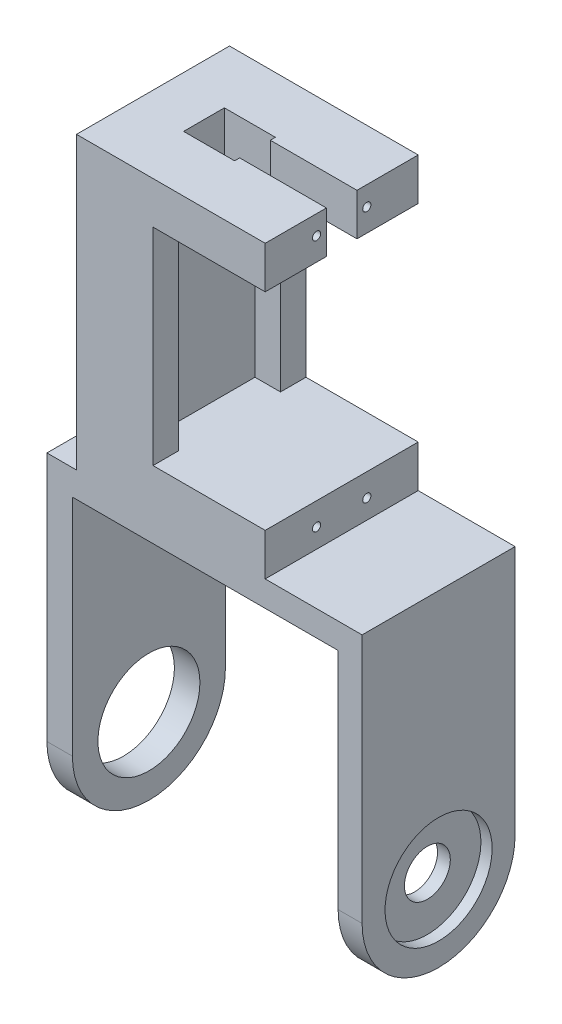
from build123d import *

# Parameters (mm, degrees)
ESQUISSE1_W               = 60.5
ESQUISSE1_H               = 64
BOSS_EXTRU_1_DEPTH        = 30
ESQUISSE2_R               = 4.5
ENL_V_MAT_EXTRU_1_DEPTH   = 32
ENL_V_MAT_EXTRU_2_REACH   = 55.283
ESQUISSE4_W               = 52.1
ESQUISSE4_H               = 83.557669167
ESQUISSE5_R               = 10.5
ENL_V_MAT_EXTRU_3_DEPTH   = 1.7
ESQUISSE6_R               = 10
ENL_V_MAT_EXTRU_4_DEPTH   = 4.2
ESQUISSE7_W               = 47
ESQUISSE7_H               = 57
BOSS_EXTRU_2_DEPTH        = 30
ENL_V_MAT_EXTRU_5_DEPTH   = 30
ENL_V_MAT_EXTRU_6_DEPTH   = 8.25
ESQUISSE11_W              = 5
ESQUISSE11_H              = 40.5
BOSS_EXTRU_3_DEPTH        = 5
ESQUISSE12_R              = 0.5
ENL_V_MAT_EXTRU_7_DEPTH   = 15
TROU_TARAUD_M2X0_42_D     = 1.6
TROU_TARAUD_M2X0_42_DEPTH = 17
TROU_TARAUD_M2X0_42_TIP   = 0.480688495
ENL_V_MAT_EXTRU_8_REACH   = 113.72
TROU_TARAUD_M3X0_54_D     = 2.5
TROU_TARAUD_M3X0_54_DEPTH = 17.5
TROU_TARAUD_M3X0_54_TIP   = 0.751075774
ENL_V_MAT_EXTRU_9_REACH   = 100.671
ESQUISSE26_W              = 5
ESQUISSE26_H              = 64.513244551
BOSS_EXTRU_4_START        = 0.8
ESQUISSE27_R              = 10
BOSS_EXTRU_4_DEPTH        = 0.8
ESQUISSE28_R              = 10.5
BOSS_EXTRU_5_DEPTH        = 0.5


with BuildPart() as part:
    # Esquisse1 → Boss.-Extru.1 (new body)
    with BuildSketch(Plane.XY):
        Rectangle(ESQUISSE1_W, ESQUISSE1_H)
    extrude(amount=BOSS_EXTRU_1_DEPTH)

    # Esquisse2 → Enlèv. mat.-Extru.1 (cut)
    with BuildSketch(Plane(origin=(30.25, 0, 0), x_dir=(0, 0, -1), z_dir=(1, 0, 0))):
        with Locations(Location((-15, -17, 0), (0, 0, 90))):
            Circle(ESQUISSE2_R)
    extrude(amount=-ENL_V_MAT_EXTRU_1_DEPTH, mode=Mode.SUBTRACT)

    # Enlèv. mat.-Extru.2: up to this face of the body (flat: up to its plane)
    enl_v_mat_extru_2_end = Plane(part.part.faces().sort_by_distance((0, 0, 0))[0])
    # Esquisse4 → Enlèv. mat.-Extru.2 (cut, up to the picked face)
    with BuildSketch(Plane.XY.offset(30), mode=Mode.PRIVATE) as enl_v_mat_extru_2_sk1:
        with Locations((0, -14.778834584)):
            Rectangle(ESQUISSE4_W, ESQUISSE4_H)
    enl_v_mat_extru_2_tool1 = split(extrude(enl_v_mat_extru_2_sk1.sketch, amount=-ENL_V_MAT_EXTRU_2_REACH, mode=Mode.PRIVATE), bisect_by=enl_v_mat_extru_2_end, keep=Keep.BOTH, mode=Mode.PRIVATE)
    add(enl_v_mat_extru_2_tool1.solids().sort_by(Axis((0, -14.778835, 30), (0, 0, -1)))[0], mode=Mode.SUBTRACT)

    # Esquisse5 → Enlèv. mat.-Extru.3 (cut)
    with BuildSketch(Plane(origin=(30.25, 0, 0), x_dir=(0, 0, -1), z_dir=(1, 0, 0))):
        with Locations(Location((-15, -17, 0), (0, 0, 90))):
            Circle(ESQUISSE5_R)
    extrude(amount=-ENL_V_MAT_EXTRU_3_DEPTH, mode=Mode.SUBTRACT)

    # Esquisse6 → Enlèv. mat.-Extru.4 (cut)
    with BuildSketch(Plane(origin=(-26.05, 0, 0), x_dir=(0, 0, -1), z_dir=(1, 0, 0))):
        with Locations((-15, -17)):
            Circle(ESQUISSE6_R)
    extrude(amount=-ENL_V_MAT_EXTRU_4_DEPTH, mode=Mode.SUBTRACT)

    # Esquisse7 → Boss.-Extru.2 (add)
    with BuildSketch(Plane.XY.offset(30)):
        with Locations((-6.75, 60.5)):
            Rectangle(ESQUISSE7_W, ESQUISSE7_H)
    extrude(amount=-BOSS_EXTRU_2_DEPTH)

    # Esquisse8 → Enlèv. mat.-Extru.5 (cut)
    with BuildSketch(Plane.XY.offset(30)):
        Polygon((-15.25, 80.75), (11.75, 80.75), (11.75, 98.556441221), (21.75, 98.556441221), (21.75, 32), (11.75, 32), (11.75, 40.25), (-15.25, 40.25), align=None)
    extrude(amount=-ENL_V_MAT_EXTRU_5_DEPTH, mode=Mode.SUBTRACT)

    # Esquisse10 → Enlèv. mat.-Extru.6 (cut)
    with BuildSketch(Plane.XZ.offset(-80.75)):
        Polygon((-5.25, 11), (-5.25, 12), (34.75, 12), (34.75, 18), (-5.25, 18), (-5.25, 19), (-15.25, 19), (-15.25, 11), align=None)
    extrude(amount=-ENL_V_MAT_EXTRU_6_DEPTH, mode=Mode.SUBTRACT)

    # Esquisse11 → Boss.-Extru.3 (add)
    with BuildSketch(Plane(origin=(-15.25, 0, 0), x_dir=(0, 0, -1), z_dir=(1, 0, 0))):
        with Locations((-27.5, 60.5)):
            Rectangle(ESQUISSE11_W, ESQUISSE11_H)
        with Locations((-2.5, 60.5)):
            Rectangle(ESQUISSE11_W, ESQUISSE11_H)
    extrude(amount=BOSS_EXTRU_3_DEPTH)

    # Esquisse12 → Enlèv. mat.-Extru.7 (cut)
    with BuildSketch(Plane(origin=(11.75, 0, 0), x_dir=(0, 0, -1), z_dir=(1, 0, 0))):
        with Locations((-19.925, 85.21)):
            Circle(ESQUISSE12_R)
        with Locations(Location((-10.075, 85.21, 0), (0, 0, 180))):
            Circle(ESQUISSE12_R)
        with Locations((-10.075, 35.79)):
            Circle(ESQUISSE12_R)
        with Locations(Location((-19.925, 35.79, 0), (0, 0, 180))):
            Circle(ESQUISSE12_R)
    extrude(amount=-ENL_V_MAT_EXTRU_7_DEPTH, mode=Mode.SUBTRACT)

    # Trou taraudé M2x0.42
    with Locations(Plane(origin=(11.75, 85.21, 19.925), x_dir=(0, 0, 1), z_dir=(1, 0, 0))):
        with Locations((0, 0), (-9.85, 0), (-9.85, 49.42), (0, 49.42)):
            Hole(TROU_TARAUD_M2X0_42_D / 2, depth=TROU_TARAUD_M2X0_42_DEPTH)
            with Locations((0, 0, -(TROU_TARAUD_M2X0_42_DEPTH + TROU_TARAUD_M2X0_42_TIP / 2))):  # 118° drill point
                Cone(0, TROU_TARAUD_M2X0_42_D / 2, TROU_TARAUD_M2X0_42_TIP, mode=Mode.SUBTRACT)

    # Enlèv. mat.-Extru.8: up to this face of the body (flat: up to its plane)
    enl_v_mat_extru_8_end = Plane(part.part.faces().sort_by_distance((30.25, 3.741727612, 15))[0])
    # Esquisse15 → Enlèv. mat.-Extru.8 (cut, up to the picked face)
    with BuildSketch(Plane.ZY.offset(30.25), mode=Mode.PRIVATE) as enl_v_mat_extru_8_sk1:
        with BuildLine():
            Line((40, -17), (30, -17))
            ThreePointArc((30, -17), (15, -32), (0, -17))
            Line((0, -17), (-10, -17))
            ThreePointArc((-10, -17), (15, -42), (40, -17))
        make_face()
    enl_v_mat_extru_8_tool1 = split(extrude(enl_v_mat_extru_8_sk1.sketch, amount=-ENL_V_MAT_EXTRU_8_REACH, mode=Mode.PRIVATE), bisect_by=enl_v_mat_extru_8_end, keep=Keep.BOTH, mode=Mode.PRIVATE)
    add(enl_v_mat_extru_8_tool1.solids().sort_by(Axis((-30.25, -17.559017, -5), (1, 0, 0)))[0], mode=Mode.SUBTRACT)

    # Trou taraudé M3x0.54
    with Locations(Plane(origin=(-30.25, 70.15, 15), x_dir=(0, -1, 0), z_dir=(-1, 0, 0))):
        with Locations((0, 0)):
            Hole(TROU_TARAUD_M3X0_54_D / 2, depth=TROU_TARAUD_M3X0_54_DEPTH)
            with Locations((0, 0, -(TROU_TARAUD_M3X0_54_DEPTH + TROU_TARAUD_M3X0_54_TIP / 2))):  # 118° drill point
                Cone(0, TROU_TARAUD_M3X0_54_D / 2, TROU_TARAUD_M3X0_54_TIP, mode=Mode.SUBTRACT)

    # Enlèv. mat.-Extru.9: up to this face of the body (flat: up to its plane)
    enl_v_mat_extru_9_end = Plane(part.part.faces().sort_by_distance((-10.488138476, 46.757965151, 0))[0])
    # Esquisse26 → Enlèv. mat.-Extru.9 (cut, up to the picked face)
    with BuildSketch(Plane.XY.offset(30), mode=Mode.PRIVATE) as enl_v_mat_extru_9_sk1:
        with Locations((-27.75, 64.256622276)):
            Rectangle(ESQUISSE26_W, ESQUISSE26_H)
    enl_v_mat_extru_9_tool1 = split(extrude(enl_v_mat_extru_9_sk1.sketch, amount=-ENL_V_MAT_EXTRU_9_REACH, mode=Mode.PRIVATE), bisect_by=enl_v_mat_extru_9_end, keep=Keep.BOTH, mode=Mode.PRIVATE)
    add(enl_v_mat_extru_9_tool1.solids().sort_by(Axis((-27.75, 64.256622, 30), (0, 0, -1)))[0], mode=Mode.SUBTRACT)

    # Esquisse27 → Boss.-Extru.4 (add)
    with BuildSketch(Plane.ZY.offset(30.25).offset(BOSS_EXTRU_4_START)):
        with BuildLine():
            Line((30, -17), (30, 32))
            Line((30, 32), (0, 32))
            Line((0, 32), (0, -17))
            ThreePointArc((0, -17), (15, -32), (30, -17))
        make_face()
        with Locations(Location((15, -17, 0), (0, 0, 180))):
            Circle(ESQUISSE27_R, mode=Mode.SUBTRACT)
    extrude(amount=-BOSS_EXTRU_4_DEPTH)

    # Esquisse28 → Boss.-Extru.5 (add)
    with BuildSketch(Plane(origin=(30.25, 0, 0), x_dir=(0, 0, -1), z_dir=(1, 0, 0))):
        with BuildLine():
            Line((-30, 32), (-30, -17))
            ThreePointArc((-30, -17), (-15, -32), (0, -17))
            Line((0, -17), (0, 32))
            Line((0, 32), (-30, 32))
        make_face()
        with Locations(Location((-15, -17, 0), (0, 0, 90))):
            Circle(ESQUISSE28_R, mode=Mode.SUBTRACT)
    extrude(amount=BOSS_EXTRU_5_DEPTH)


solid = part.part
